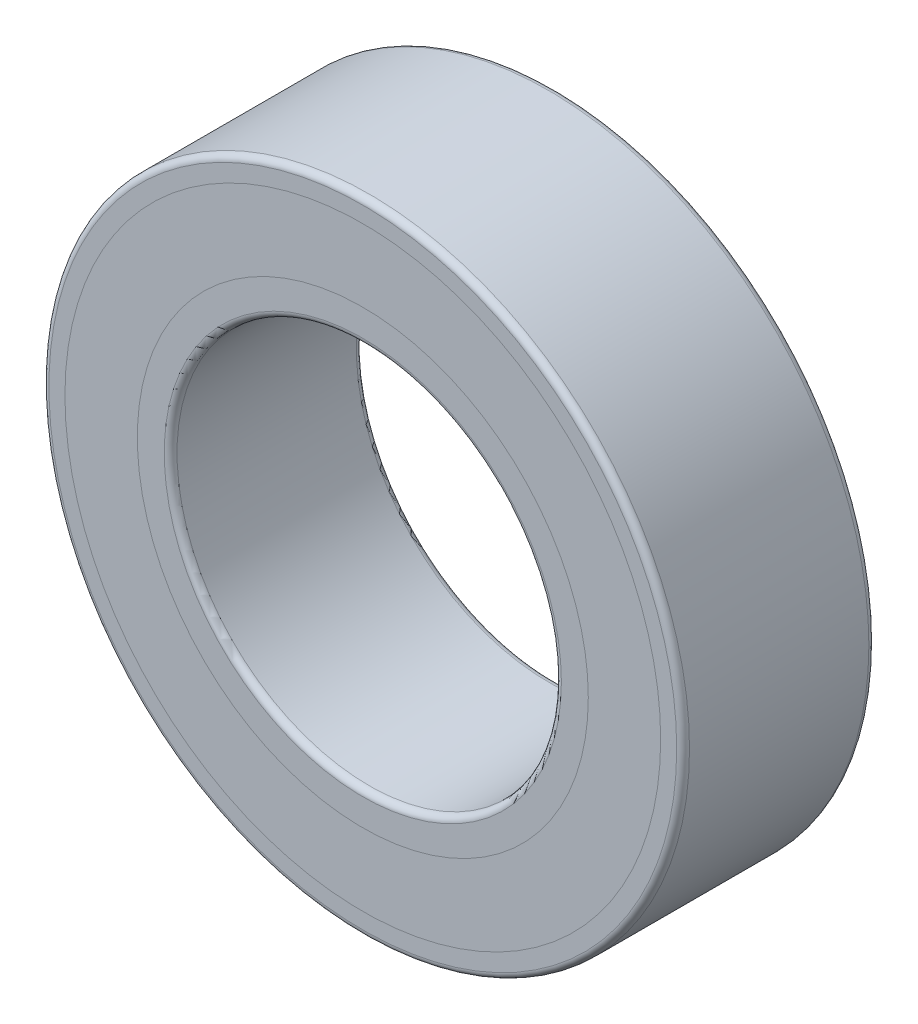
from build123d import *

# Parameters (mm, degrees)
SKETCH_1_R      = 5
SKETCH_1_R_2    = 3
EXTRUDE_1_DEPTH = 3
FILLET_1_R      = 0.1


with BuildPart() as part:
    # ｽｹｯﾁ1 → ﾎﾞｽ - 押し出し1 (new body)
    with BuildSketch(Plane.XY):
        Circle(SKETCH_1_R)
        Circle(SKETCH_1_R_2, mode=Mode.SUBTRACT)
    extrude(amount=EXTRUDE_1_DEPTH)

    # ﾌｨﾚｯﾄ1
    fillet_1_edges = [part.edges().sort_by_distance(p)[0] for p in [
        (-5, 0, 0),
        (-5, 0, 3),
        (-3, 0, 0),
        (-3, 0, 3),
    ]]
    fillet(fillet_1_edges, radius=FILLET_1_R)


solid = part.part
